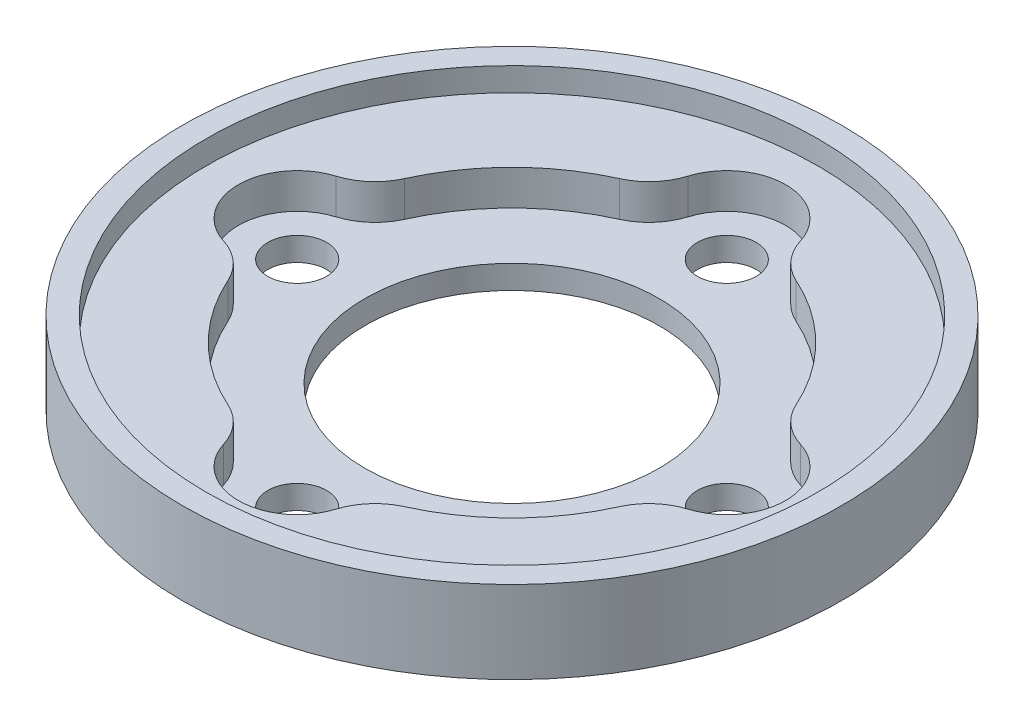
from build123d import *

# Parameters (mm, degrees)
SKETCH1_R           = 28
SKETCH1_R_2         = 12.5
SKETCH1_R_3         = 2.5
BOSS_EXTRUDE1_DEPTH = 5
SKETCH2_R           = 28
SKETCH2_R_2         = 26
BOSS_EXTRUDE2_DEPTH = 2
CUT_EXTRUDE1_DEPTH  = 3
FILLET1_R           = 5


with BuildPart() as part:
    # Sketch1 → Boss-Extrude1 (new body)
    with BuildSketch(Plane(origin=(0, 0, 0), x_dir=(1, 0, 0), z_dir=(0, 1, 0))):
        with Locations(Location((0, 0, 0), (0, 0, 270))):
            Circle(SKETCH1_R)
        with Locations(Location((0, 0, 0), (0, 0, 270))):
            Circle(SKETCH1_R_2, mode=Mode.SUBTRACT)
        with Locations(Location((18.25, 0, 0), (0, 0, 270))):
            Circle(SKETCH1_R_3, mode=Mode.SUBTRACT)
        with Locations(Location((0, -18.25, 0), (0, 0, 270))):
            Circle(SKETCH1_R_3, mode=Mode.SUBTRACT)
        with Locations(Location((-18.25, 0, 0), (0, 0, 270))):
            Circle(SKETCH1_R_3, mode=Mode.SUBTRACT)
        with Locations(Location((0, 18.25, 0), (0, 0, 270))):
            Circle(SKETCH1_R_3, mode=Mode.SUBTRACT)
    extrude(amount=BOSS_EXTRUDE1_DEPTH)

    # Sketch2 → Boss-Extrude2 (add)
    with BuildSketch(Plane(origin=(0, 5, 0), x_dir=(1, 0, 0), z_dir=(0, 1, 0))):
        with Locations(Location((0, 0, 0), (0, 0, 270))):
            Circle(SKETCH2_R)
        with Locations(Location((0, 0, 0), (0, 0, 270))):
            Circle(SKETCH2_R_2, mode=Mode.SUBTRACT)
    extrude(amount=BOSS_EXTRUDE2_DEPTH)

    # Sketch4 → Cut-Extrude1 (cut)
    with BuildSketch(Plane(origin=(0, 5, 0), x_dir=(1, 0, 0), z_dir=(0, 1, 0))):
        with BuildLine():
            ThreePointArc((4.95286471, 17.565068493), (0, 23.25), (-4.95286471, 17.565068493))
            ThreePointArc((-4.95286471, 17.565068493), (-12.904698757, 12.904698757), (-17.565068493, 4.95286471))
            ThreePointArc((-17.565068493, 4.95286471), (-23.25, 0), (-17.565068493, -4.95286471))
            ThreePointArc((-17.565068493, -4.95286471), (-12.904698757, -12.904698757), (-4.95286471, -17.565068493))
            ThreePointArc((-4.95286471, -17.565068493), (0, -23.25), (4.95286471, -17.565068493))
            ThreePointArc((4.95286471, -17.565068493), (12.904698757, -12.904698757), (17.565068493, -4.95286471))
            ThreePointArc((17.565068493, -4.95286471), (23.25, 0), (17.565068493, 4.95286471))
            ThreePointArc((17.565068493, 4.95286471), (12.904698757, 12.904698757), (4.95286471, 17.565068493))
        make_face()
    extrude(amount=-CUT_EXTRUDE1_DEPTH, mode=Mode.SUBTRACT)

    # Fillet1
    fillet1_edges = [part.edges().sort_by_distance(p)[0] for p in [
        (-4.95286471, 3.5, 17.565068493),
        (-17.565068493, 3.5, 4.95286471),
        (-17.565068493, 3.5, -4.95286471),
        (-4.95286471, 3.5, -17.565068493),
        (4.95286471, 3.5, -17.565068493),
        (17.565068493, 3.5, -4.95286471),
        (17.565068493, 3.5, 4.95286471),
        (4.95286471, 3.5, 17.565068493),
    ]]
    fillet(fillet1_edges, radius=FILLET1_R)


solid = part.part
